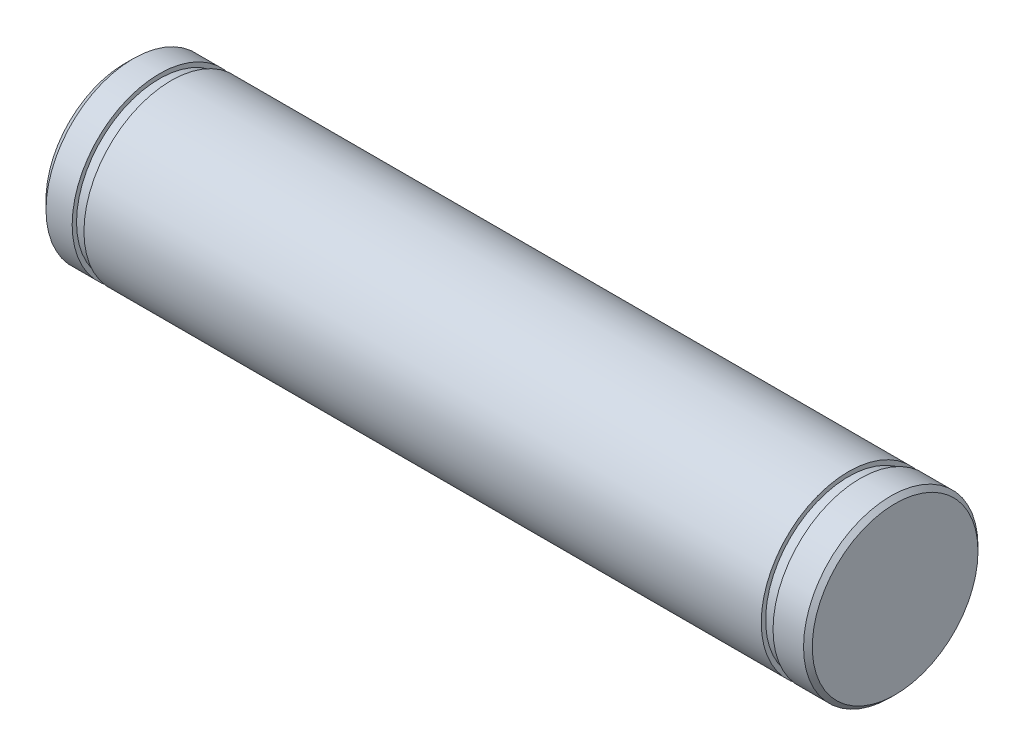
from build123d import *

# Parameters (mm, degrees)
SKETCH1_R           = 10
BOSS_EXTRUDE1_DEPTH = 44.175
SKETCH2_R           = 10
SKETCH2_R_2         = 9.5
CUT_EXTRUDE1_DEPTH  = 1.35
CHAMFER1_SIZE       = 0.5
CHAMFER2_SIZE       = 1


with BuildPart() as part:
    # Sketch1 → Boss-Extrude1 (new, symmetric)
    with BuildSketch(Plane(origin=(0, 0, 0), x_dir=(0, 0, -1), z_dir=(1, 0, 0))):
        Circle(SKETCH1_R)
    extrude(amount=BOSS_EXTRUDE1_DEPTH, both=True)

    # Sketch2 → Cut-Extrude1 (cut)
    with BuildSketch(Plane(origin=(40.175, 0, 0), x_dir=(0, 0, -1), z_dir=(1, 0, 0))):
        Circle(SKETCH2_R)
        Circle(SKETCH2_R_2, mode=Mode.SUBTRACT)
    cut_extrude1 = extrude(amount=-CUT_EXTRUDE1_DEPTH, mode=Mode.SUBTRACT)

    # Chamfer1
    chamfer1_edges = [part.edges().sort_by_distance(p)[0] for p in [
        (44.175, 0, 10),
    ]]
    chamfer(chamfer1_edges, length=CHAMFER1_SIZE)

    # Chamfer2
    chamfer2_edges = [part.edges().sort_by_distance(p)[0] for p in [
        (-44.175, 0, 10),
    ]]
    chamfer(chamfer2_edges, length=CHAMFER2_SIZE)

    # Mirror1: Cut-Extrude1 across plane
    add(cut_extrude1.mirror(Plane(origin=(0, 0, 0), x_dir=(0, 0, 1), z_dir=(1, 0, 0))), mode=Mode.SUBTRACT)


solid = part.part
